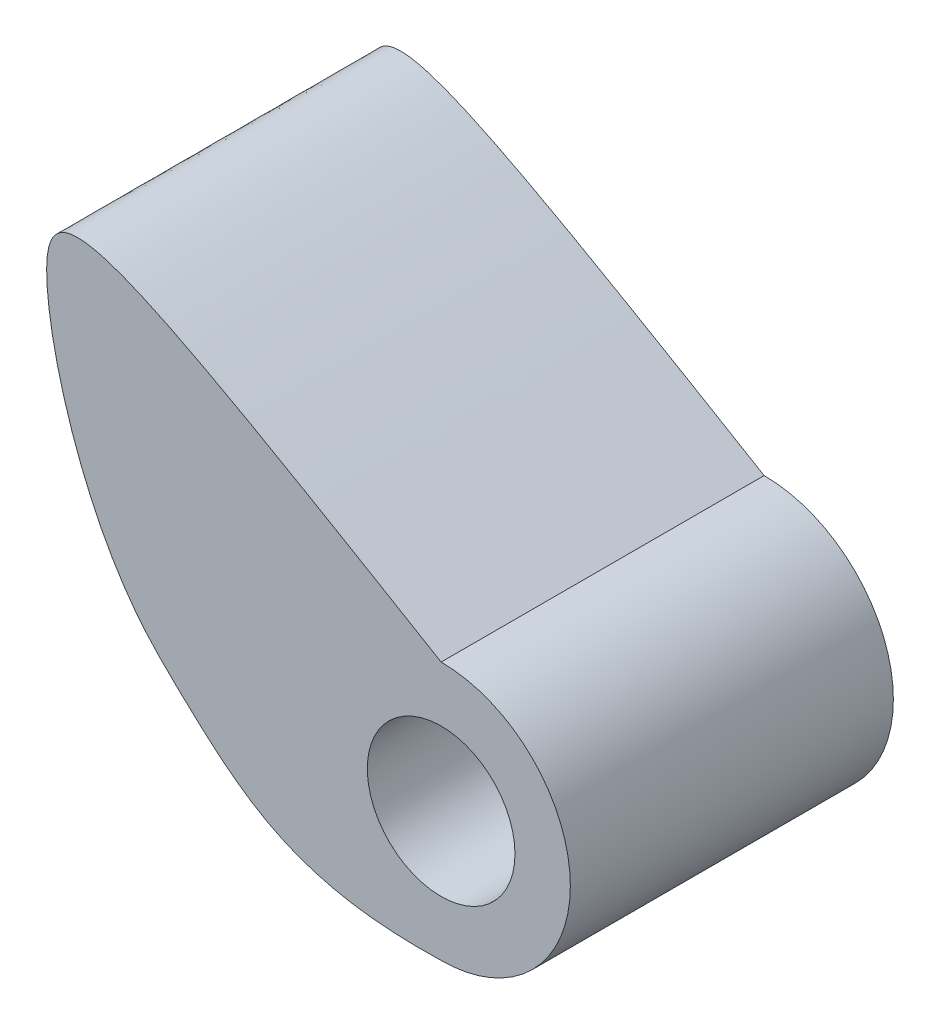
from build123d import *

# Parameters (mm, degrees)
BOSS_EXTRU_1_DEPTH = 17.5


with BuildPart() as part:
    # Esquisse1 → Boss.-Extru.1 (new body)
    # profile 1 of 3: a face of its own
    with BuildSketch(Plane.XY):
        with BuildLine():
            add(Edge.make_bspline(
                [(-20.710281644, 16.775882713), (-19.008192971, 18.084424308), (-13.618564496, 15.074724082), (0, 7)],
                knots=[0.689233926, 0.689233926, 0.689233926, 0.689233926, 1, 1, 1, 1], degree=3))
            Line((-20.710281644, 16.775882713), (-5.439375908, 4.406040142))
            ThreePointArc((-5.439375908, 4.406040142), (-3.013114585, 6.318317853), (0, 7))
        make_face()
    # profile 2 of 3: a face of its own
    with BuildSketch(Plane.XY):
        with BuildLine():
            Line((-5.439375908, 4.406040142), (-20.710281644, 16.775882713))
            add(Edge.make_bspline(
                [(0, -7), (-7.674490293, -7.224400301), (-11.12841933, -4.41044745), (-19.073866035, 3.253299449), (-21.862995185, 13.248099666), (-21.252830739, 16.358778675), (-20.710281644, 16.775882713)],
                knots=[0, 0, 0, 0, 0.27018184, 0.329199412, 0.590175719, 0.689233926, 0.689233926, 0.689233926, 0.689233926], degree=3))
            ThreePointArc((0, -7), (-6.318317853, -3.013114585), (-5.439375908, 4.406040142))
        make_face()
    # profile 3 of 3: a face of its own
    with BuildSketch(Plane.XY):
        with BuildLine():
            ThreePointArc((0, 7), (-3.013114585, 6.318317853), (-5.439375908, 4.406040142))
            ThreePointArc((-5.439375908, 4.406040142), (-6.318317853, -3.013114585), (0, -7))
            ThreePointArc((0, -7), (4.949747468, -4.949747468), (7, 0))
            ThreePointArc((7, 0), (4.949747468, 4.949747468), (0, 7))
        make_face()
        with BuildLine():
            ThreePointArc((4, 0), (-1.335503797, -3.770468089), (-3.108214805, 2.517737224))
            ThreePointArc((-3.108214805, 2.517737224), (1.335503797, 3.770468089), (4, 0))
        make_face(mode=Mode.SUBTRACT)
    extrude(amount=-BOSS_EXTRU_1_DEPTH)


solid = part.part
